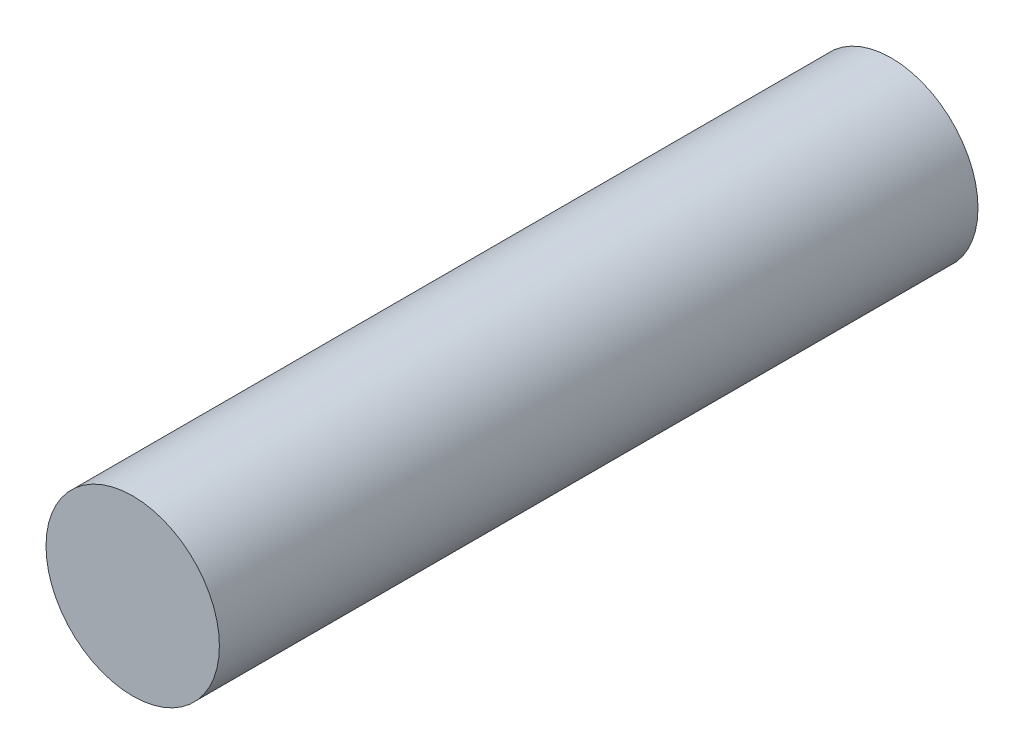
from build123d import *

# Parameters (mm, degrees)
SKETCH1_R           = 4
BOSS_EXTRUDE1_DEPTH = 35


with BuildPart() as part:
    # Sketch1 → Boss-Extrude1 (new body)
    with BuildSketch(Plane.XY):
        with Locations((-2.967610387, 0.421327401)):
            Circle(SKETCH1_R)
    extrude(amount=BOSS_EXTRUDE1_DEPTH)


solid = part.part
